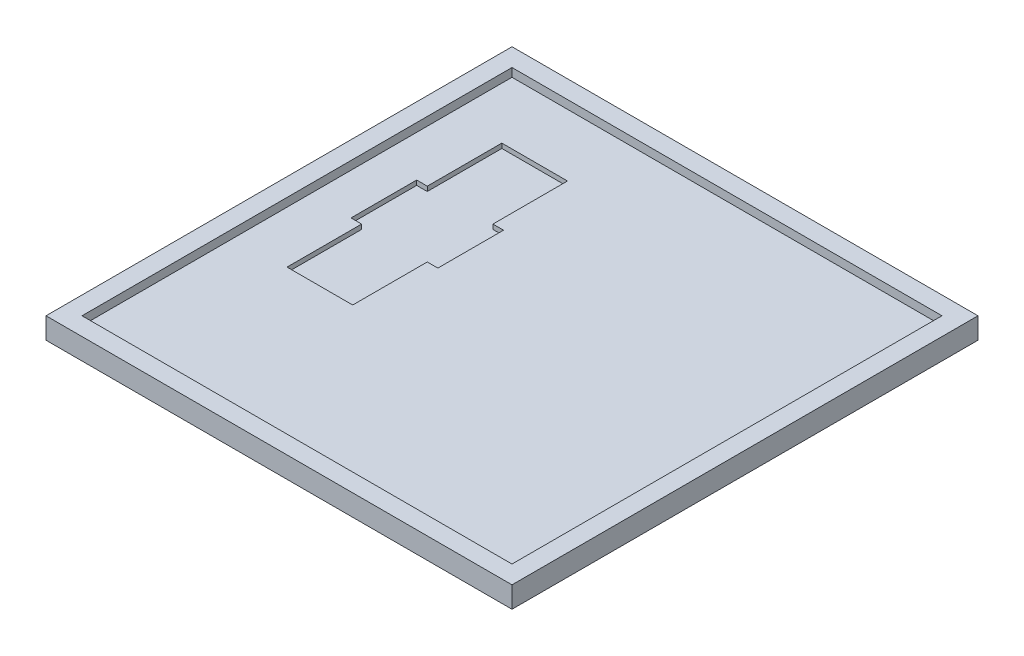
from build123d import *

# Parameters (mm, degrees)
SKETCH1_W           = 110
SKETCH1_H           = 110
BOSS_EXTRUDE1_DEPTH = 5
SKETCH2_W           = 101.5
SKETCH2_H           = 101.5
CUT_EXTRUDE1_DEPTH  = 2
CUT_EXTRUDE2_DEPTH  = 1.1


with BuildPart() as part:
    # Sketch1 → Boss-Extrude1 (new body)
    with BuildSketch(Plane(origin=(0, 0, 0), x_dir=(1, 0, 0), z_dir=(0, 1, 0))):
        with Locations((-13.863013699, -16.650684932)):
            Rectangle(SKETCH1_W, SKETCH1_H)
    extrude(amount=BOSS_EXTRUDE1_DEPTH)

    # Sketch2 → Cut-Extrude1 (cut)
    with BuildSketch(Plane(origin=(0, 5, 0), x_dir=(1, 0, 0), z_dir=(0, 1, 0))):
        with Locations((-13.863013699, -16.650684932)):
            Rectangle(SKETCH2_W, SKETCH2_H)
    extrude(amount=-CUT_EXTRUDE1_DEPTH, mode=Mode.SUBTRACT)

    # Sketch3 → Cut-Extrude2 (cut)
    with BuildSketch(Plane(origin=(0, 3, 0), x_dir=(1, 0, 0), z_dir=(0, 1, 0))):
        Polygon((-34.363013699, 1.849315068), (-36.863013699, 1.849315068), (-36.863013699, 19.449315068), (-52.363013699, 19.449315068), (-52.363013699, 1.849315068), (-54.863013699, 1.849315068), (-54.863013699, -13.650684932), (-52.363013699, -13.650684932), (-52.363013699, -31.250684932), (-36.863013699, -31.250684932), (-36.863013699, -13.650684932), (-34.363013699, -13.650684932), align=None)
    extrude(amount=-CUT_EXTRUDE2_DEPTH, mode=Mode.SUBTRACT)


solid = part.part
